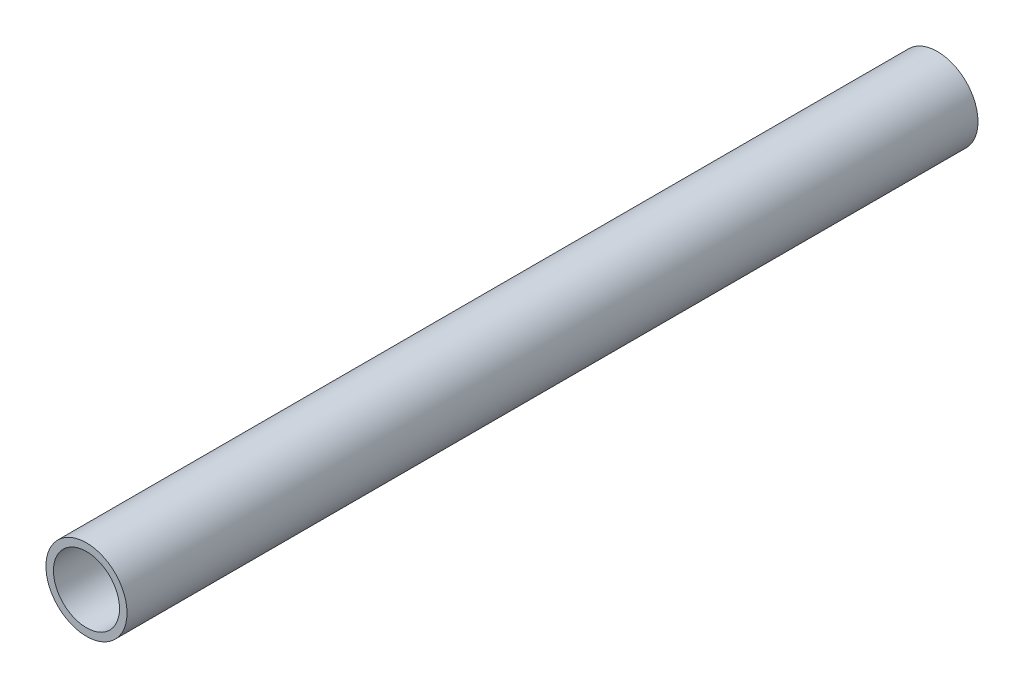
from build123d import *

# Parameters (mm, degrees)
CROQUIS1_R              = 8.1
CROQUIS1_R_2            = 6.6
SALIENTE_EXTRUIR1_DEPTH = 85


with BuildPart() as part:
    # Croquis1 → Saliente-Extruir1 (new, symmetric)
    with BuildSketch(Plane.XY):
        Circle(CROQUIS1_R)
        Circle(CROQUIS1_R_2, mode=Mode.SUBTRACT)
    extrude(amount=SALIENTE_EXTRUIR1_DEPTH, both=True)


solid = part.part
